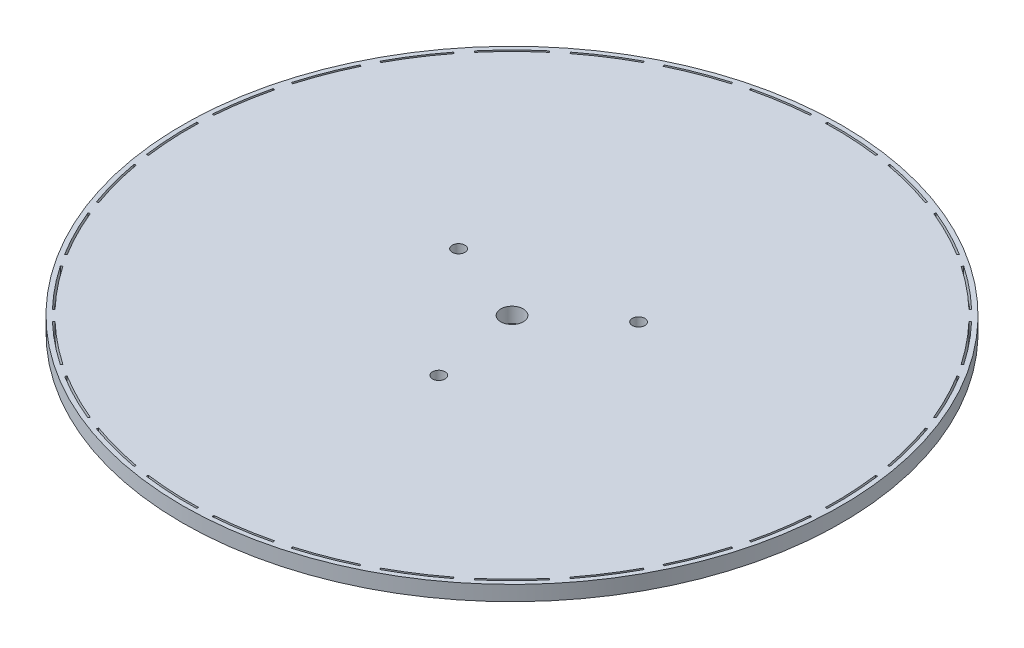
from build123d import *

# Parameters (mm, degrees)
SKETCH5_R           = 139.7
BOSS_EXTRUDE2_DEPTH = 6.35
CUT_EXTRUDE1_DEPTH  = 6.35
CIRPATTERN1_COUNT   = 30
SKETCH9_R           = 2.667
CUT_EXTRUDE3_DEPTH  = 6.35
SKETCH10_R          = 4.7625
CUT_EXTRUDE4_DEPTH  = 6.35


with BuildPart() as part:
    # Sketch5 → Boss-Extrude2 (new body)
    with BuildSketch(Plane(origin=(0, 0, 0), x_dir=(1, 0, 0), z_dir=(0, 1, 0))):
        with Locations(Location((0, 0, 0), (0, 0, 270))):
            Circle(SKETCH5_R)
    extrude(amount=BOSS_EXTRUDE2_DEPTH)

    # Sketch7 → Cut-Extrude1 (cut)
    with BuildSketch(Plane(origin=(0, 6.35, 0), x_dir=(1, 0, 0), z_dir=(0, 1, 0))):
        with BuildLine():
            Line((129.737413632, 46.429145255), (128.9900783, 46.161696262))
            ThreePointArc((128.9900783, 46.161696262), (129.021453099, 46.073931262), (129.052768182, 45.986144937))
            ThreePointArc((129.052768182, 45.986144937), (132.363362319, 35.345195107), (134.798156694, 24.470379101))
            Line((134.798156694, 24.470379101), (135.579142539, 24.612154183))
            ThreePointArc((135.579142539, 24.612154183), (133.106025481, 35.640538795), (129.737413632, 46.429145255))
        make_face()
    cut_extrude1 = extrude(amount=-CUT_EXTRUDE1_DEPTH, mode=Mode.SUBTRACT)

    # CirPattern1: Cut-Extrude1 ×30 about axis
    cirpattern1_axis = Axis((0, 0, 0), (0, 1, 0))
    for i in range(1, CIRPATTERN1_COUNT):
        add(cut_extrude1.rotate(cirpattern1_axis, i * 360 / CIRPATTERN1_COUNT), mode=Mode.SUBTRACT)

    # Sketch9 → Cut-Extrude3 (cut)
    with BuildSketch(Plane(origin=(0, 6.35, 0), x_dir=(1, 0, 0), z_dir=(0, 1, 0))):
        with Locations(Location((29.251429164, 24.412371697, 0), (0, 0, 270))):
            Circle(SKETCH9_R)
        with Locations(Location((6.516019475, -37.538666601, 0), (0, 0, 270))):
            Circle(SKETCH9_R)
        with Locations(Location((-35.767448638, 13.126294904, 0), (0, 0, 270))):
            Circle(SKETCH9_R)
    extrude(amount=-CUT_EXTRUDE3_DEPTH, mode=Mode.SUBTRACT)

    # Sketch10 → Cut-Extrude4 (cut)
    with BuildSketch(Plane(origin=(0, 6.35, 0), x_dir=(1, 0, 0), z_dir=(0, 1, 0))):
        with Locations(Location((0, 0, 0), (0, 0, 270))):
            Circle(SKETCH10_R)
    extrude(amount=-CUT_EXTRUDE4_DEPTH, mode=Mode.SUBTRACT)


solid = part.part
